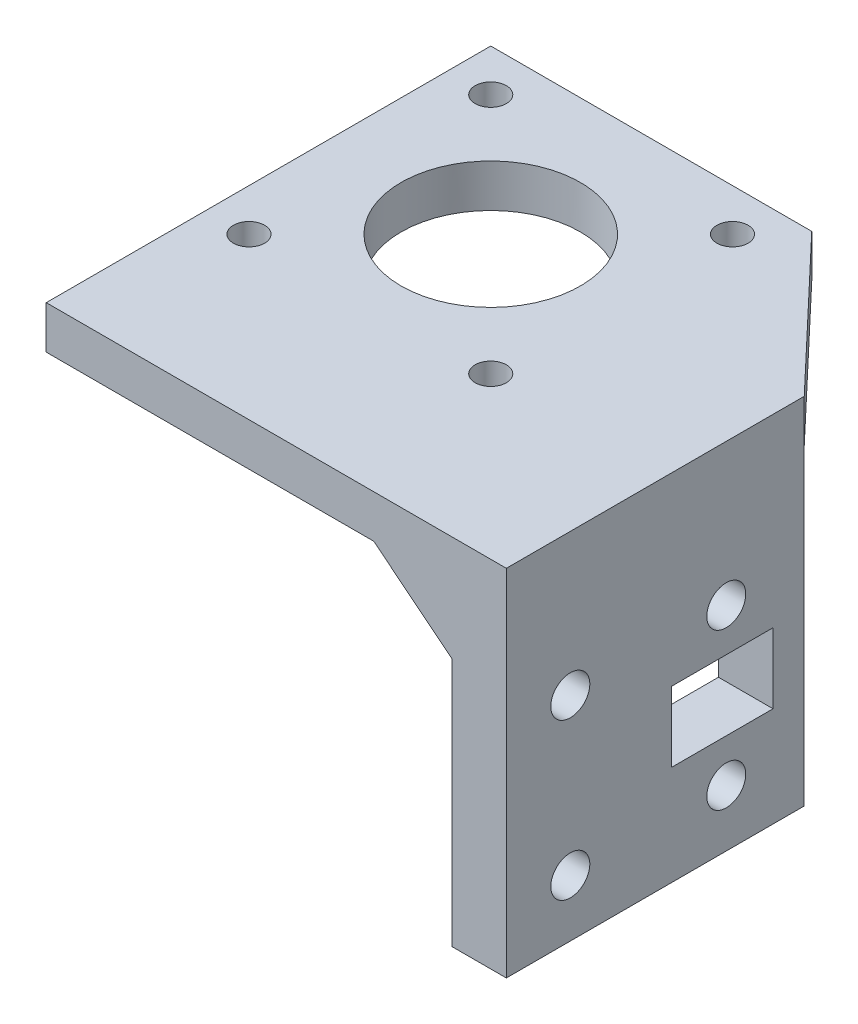
from build123d import *

# Parameters (mm, degrees)
SKETCH1_W           = 59
SKETCH1_H           = 57
BOSS_EXTRUDE1_DEPTH = 5.5
SKETCH2_R           = 2
CUT_EXTRUDE1_DEPTH  = 10
SKETCH4_W           = 7
SKETCH4_H           = 57
BOSS_EXTRUDE3_DEPTH = 40
SKETCH5_R           = 2.5
CUT_EXTRUDE2_DEPTH  = 33
SKETCH6_W           = 18.8
SKETCH6_H           = 40
CUT_EXTRUDE3_DEPTH  = 33
CUT_EXTRUDE4_DEPTH  = 33
BOSS_EXTRUDE6_DEPTH = 38.2
SKETCH10_W          = 13
SKETCH10_H          = 9
CUT_EXTRUDE8_DEPTH  = 10
SKETCH11_R          = 11.5
CUT_EXTRUDE9_DEPTH  = 10


with BuildPart() as part:
    # Sketch1 → Boss-Extrude1 (new body)
    with BuildSketch(Plane(origin=(0, 0, 0), x_dir=(1, 0, 0), z_dir=(0, 1, 0))):
        with Locations((-29.5, -28.5)):
            Rectangle(SKETCH1_W, SKETCH1_H)
    extrude(amount=BOSS_EXTRUDE1_DEPTH)

    # Sketch2 → Cut-Extrude1 (cut)
    with BuildSketch(Plane(origin=(0, 5.5, 0), x_dir=(1, 0, 0), z_dir=(0, 1, 0))):
        with Locations(Location((-53.6, -5.4, 0), (0, 0, 270))):
            Circle(SKETCH2_R)
        with Locations(Location((-22.6, -5.4, 0), (0, 0, 270))):
            Circle(SKETCH2_R)
        with Locations(Location((-53.6, -36.4, 0), (0, 0, 270))):
            Circle(SKETCH2_R)
        with Locations(Location((-22.6, -36.4, 0), (0, 0, 270))):
            Circle(SKETCH2_R)
    extrude(amount=-CUT_EXTRUDE1_DEPTH, mode=Mode.SUBTRACT)

    # Sketch4 → Boss-Extrude3 (add)
    with BuildSketch(Plane(origin=(0, 0, 0), x_dir=(-1, 0, 0), z_dir=(0, -1, 0))):
        with Locations((3.5, -28.5)):
            Rectangle(SKETCH4_W, SKETCH4_H)
    extrude(amount=BOSS_EXTRUDE3_DEPTH)

    # Sketch5 → Cut-Extrude2 (cut)
    with BuildSketch(Plane.ZY.offset(7)):
        with Locations((48.8, -32.7)):
            Circle(SKETCH5_R)
        with Locations((48.8, -12.7)):
            Circle(SKETCH5_R)
        with Locations((28.8, -32.7)):
            Circle(SKETCH5_R)
        with Locations((28.8, -12.7)):
            Circle(SKETCH5_R)
    extrude(amount=-CUT_EXTRUDE2_DEPTH, mode=Mode.SUBTRACT)

    # Sketch6 → Cut-Extrude3 (cut)
    with BuildSketch(Plane.ZY.offset(7)):
        with Locations((9.4, -20)):
            Rectangle(SKETCH6_W, SKETCH6_H)
    extrude(amount=-CUT_EXTRUDE3_DEPTH, mode=Mode.SUBTRACT)

    # Sketch7 → Cut-Extrude4 (cut)
    with BuildSketch(Plane(origin=(0, 0, 0), x_dir=(-1, 0, 0), z_dir=(0, -1, 0))):
        Polygon((0, 0), (0, -18.8), (17.836375114, 0), align=None)
    extrude(amount=-CUT_EXTRUDE4_DEPTH, mode=Mode.SUBTRACT)

    # Sketch8 → Boss-Extrude6 (add)
    with BuildSketch(Plane.XY.offset(57)):
        Polygon((-7, 0), (-7, -8), (-17, 0), align=None)
    extrude(amount=-BOSS_EXTRUDE6_DEPTH)

    # Sketch10 → Cut-Extrude8 (cut)
    with BuildSketch(Plane.ZY.offset(7)):
        with Locations((29.3, -22.7)):
            Rectangle(SKETCH10_W, SKETCH10_H)
    extrude(amount=-CUT_EXTRUDE8_DEPTH, mode=Mode.SUBTRACT)

    # Sketch11 → Cut-Extrude9 (cut)
    with BuildSketch(Plane(origin=(0, 5.5, 0), x_dir=(1, 0, 0), z_dir=(0, 1, 0))):
        with Locations(Location((-38.1, -20.9, 0), (0, 0, 270))):
            Circle(SKETCH11_R)
    extrude(amount=-CUT_EXTRUDE9_DEPTH, mode=Mode.SUBTRACT)


solid = part.part
